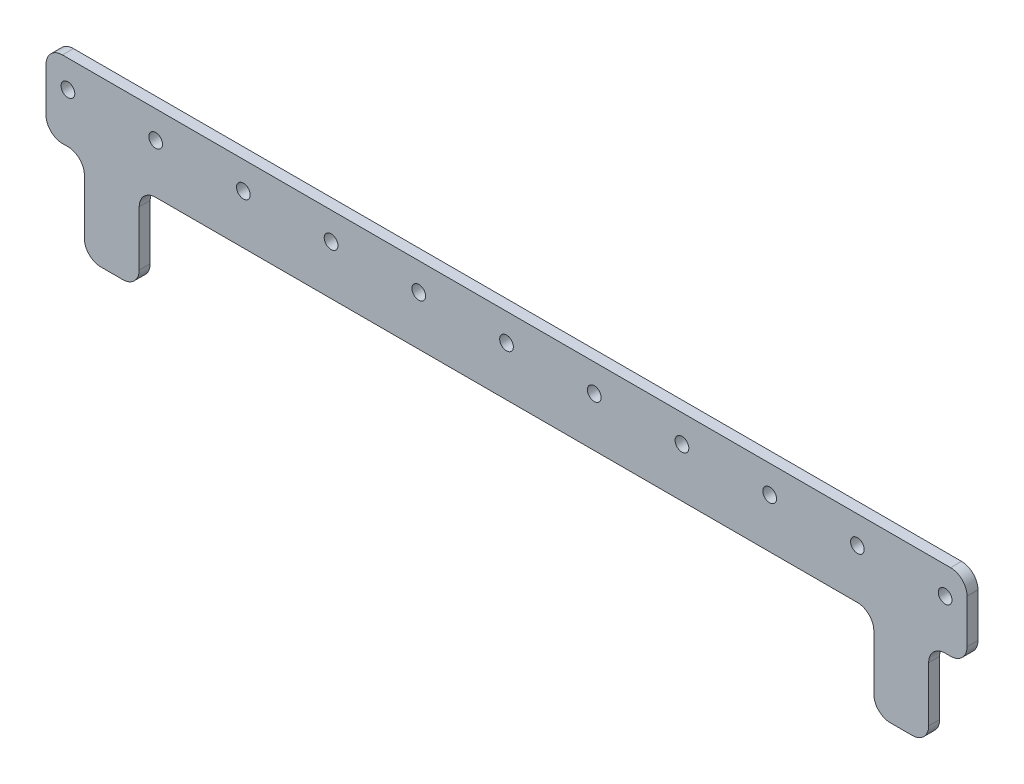
from build123d import *

# Parameters (mm, degrees)
BASE_SKETCH_W            = 168
BASE_SKETCH_H            = 14
BASE_EXTRUDE_DEPTH       = 2
PIN_HOLE_SKETCH_R        = 1.25
FIRST_PIN_HOLE_CUT_DEPTH = 85.314885993
PIN_HOLE_PATTERN_COUNT   = 11
PIN_HOLE_PATTERN_PITCH   = 16
EXTENSION_SKETCH_W       = 10
EXTENSION_SKETCH_H       = 25
TAB_EXTRUDE_DEPTH        = 2
CORNER_FILLETS_R         = 3


with BuildPart() as part:
    # Base Sketch → Base Extrude (new body)
    with BuildSketch(Plane.XY):
        Rectangle(BASE_SKETCH_W, BASE_SKETCH_H)
    extrude(amount=-BASE_EXTRUDE_DEPTH)

    # Pin Hole Sketch → First Pin Hole Cut (cut, through all)
    with BuildSketch(Plane.XY):
        with Locations((80, 2)):
            Circle(PIN_HOLE_SKETCH_R)
    first_pin_hole_cut = extrude(amount=-FIRST_PIN_HOLE_CUT_DEPTH, mode=Mode.SUBTRACT)

    # Pin Hole Pattern: First Pin Hole Cut ×11
    with Locations(*[(-i * PIN_HOLE_PATTERN_PITCH, 0, 0) for i in range(1, PIN_HOLE_PATTERN_COUNT)]):
        add(first_pin_hole_cut, mode=Mode.SUBTRACT)


with BuildPart() as body_2:
    # Extension Sketch → Tab Extrude (new, through all)
    with BuildSketch(Plane.XY):
        with Locations((72, -10.5)):
            Rectangle(EXTENSION_SKETCH_W, EXTENSION_SKETCH_H)
    tab_extrude = extrude(amount=-TAB_EXTRUDE_DEPTH)


with BuildPart() as part_1:
    add(part.part)

    # Tab Mirror: Tab Extrude across plane
    add(tab_extrude.mirror(Plane(origin=(0, 0, 0), x_dir=(0, 0, 1), z_dir=(1, 0, 0))))

    # Combine Bodies: union body 2
    add(body_2.part)

    # Corner Fillets
    corner_fillets_edges = [part_1.edges().sort_by_distance(p)[0] for p in [
        (-77, -7, -1),
        (-77, -23, -1),
        (-67, -23, -1),
        (-67, -7, -1),
        (77, -7, -1),
        (77, -23, -1),
        (67, -7, -1),
        (67, -23, -1),
        (-84, 7, -1),
        (84, 7, -1),
        (84, -7, -1),
        (-84, -7, -1),
    ]]
    fillet(corner_fillets_edges, radius=CORNER_FILLETS_R)


solid = part_1.part
